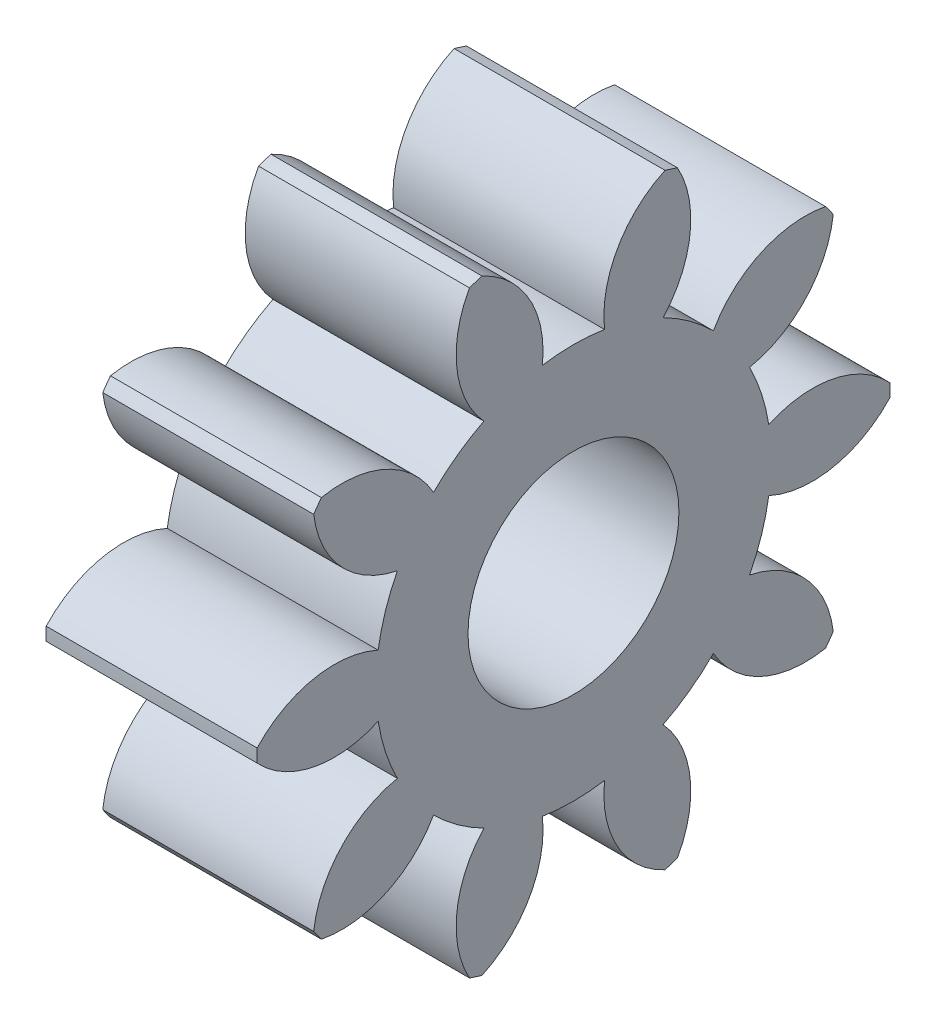
from build123d import *

# Parameters (mm, degrees)
BASPROSKE_W        = 12
BASPROSKE_H        = 9
TOOTHCUT_DEPTH     = 18.492855685
TEETHCUTS_COUNT    = 10
TEETHCUTS_ANGLE    = 324
BORSKE_R           = 0.4
BORE_DEPTH         = 50.0000508
SKETCH1_R          = 3
SKETCH1_R_2        = 0.4
CUT_EXTRUDE2_DEPTH = 18.298122882
SKETCH2_R          = 20.440784698
CUT_EXTRUDE3_DEPTH = 6


with BuildPart() as part:
    # BasProSke → Base-Revolve (revolve)
    with BuildSketch(Plane(origin=(0, 0, 0), x_dir=(1, 0, 0), z_dir=(0, 1, 0)), mode=Mode.PRIVATE) as base_revolve_sk:
        with Locations((6, 4.5)):
            Rectangle(BASPROSKE_W, BASPROSKE_H)
    revolve(base_revolve_sk.sketch.rotate(Axis((-10, 0, 0), (1, 0, 0)), 180), axis=Axis((-10, 0, 0), (1, 0, 0)))

    # TooCutSke → ToothCut (cut, through all)
    with BuildSketch(Plane(origin=(0, 0, 0), x_dir=(0, 0, -1), z_dir=(1, 0, 0))):
        with BuildLine():
            ThreePointArc((0.883878355, 5.554109745), (0, 5.624), (-0.883878355, 5.554109745))
            ThreePointArc((-0.883878355, 5.554109745), (-1.258245767, 7.379188248), (-2.637816971, 8.631324741))
            ThreePointArc((-2.637816971, 8.631324741), (0, 9.0254), (2.637816971, 8.631324741))
            ThreePointArc((2.637816971, 8.631324741), (1.258245767, 7.379188248), (0.883878355, 5.554109745))
        make_face()
    toothcut = extrude(amount=TOOTHCUT_DEPTH, mode=Mode.SUBTRACT)

    # TeethCuts: ToothCut ×10 about axis
    teethcuts_axis = Axis((-10, 0, 0), (1, 0, 0))
    for i in range(1, TEETHCUTS_COUNT):
        add(toothcut.rotate(teethcuts_axis, i * TEETHCUTS_ANGLE / (TEETHCUTS_COUNT - 1)), mode=Mode.SUBTRACT)

    # BorSke → Bore (cut, symmetric)
    with BuildSketch(Plane(origin=(0, 0, 0), x_dir=(0, 0, -1), z_dir=(1, 0, 0))):
        with Locations(Location((0, 0, 0), (0, 0, 180))):
            Circle(BORSKE_R)
    extrude(amount=BORE_DEPTH, both=True, mode=Mode.SUBTRACT)

    # Sketch1 → Cut-Extrude2 (cut, through all)
    with BuildSketch(Plane.ZY):
        Circle(SKETCH1_R)
        Circle(SKETCH1_R_2, mode=Mode.SUBTRACT)
    extrude(amount=-CUT_EXTRUDE2_DEPTH, mode=Mode.SUBTRACT)

    # Sketch2 → Cut-Extrude3 (cut)
    with BuildSketch(Plane(origin=(12, 0, 0), x_dir=(0, 0, -1), z_dir=(1, 0, 0))):
        Circle(SKETCH2_R)
    extrude(amount=-CUT_EXTRUDE3_DEPTH, mode=Mode.SUBTRACT)


solid = part.part
